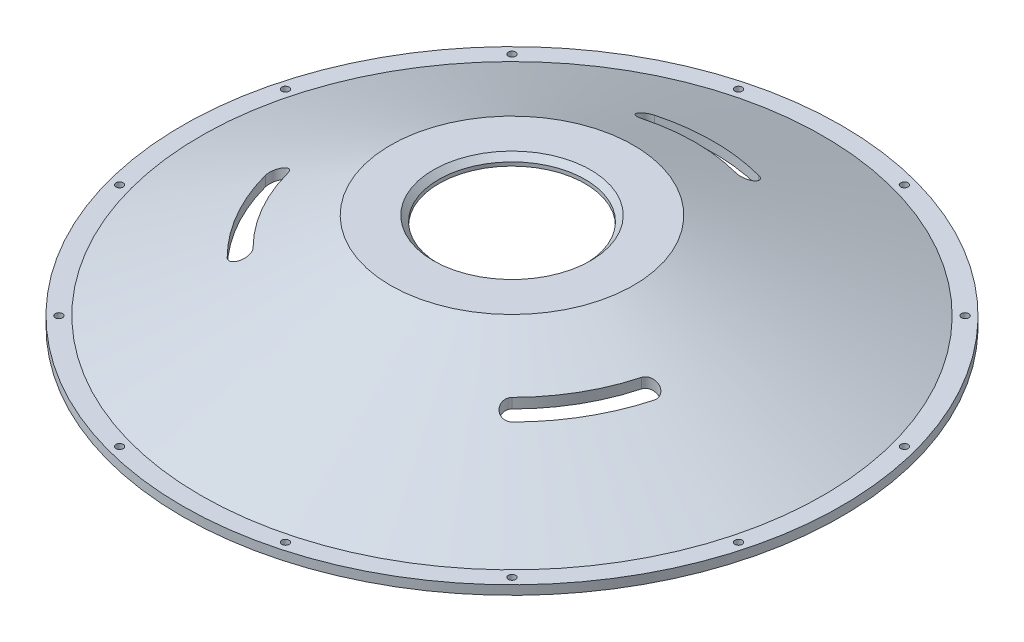
from build123d import *

# Parameters (mm, degrees)
SKETCH_1_R               = 60
SKETCH_1_R_2             = 50
EXTRUDE_1_DEPTH          = 5
SKETCH_2_R               = 53.534713893
SKETCH_2_R_2             = 39.971865105
EXTRUDE_2_DEPTH          = 5
CHAMFER_1_SIZE           = 3
SKETCH_5_R               = 2
CUT_EXTRUDE_1_DEPTH      = 50
PATTERN_CIRCULAR_1_COUNT = 8
EXTRUDE_1213_REACH       = 260.082
SKETCH_6_R               = 3.4
PATTERN_CIRCULAR_2_COUNT = 6
CUT_EXTRUDE_2_DEPTH      = 500
PATTERN_CIRCULAR_3_COUNT = 3
SKETCH_8_R               = 2
EXTRUDE_3_DEPTH          = 5
PATTERN_CIRCULAR_4_COUNT = 4
SKETCH_9_R               = 2
CUT_EXTRUDE_3_DEPTH      = 50
PATTERN_CIRCULAR_5_COUNT = 4
SKETCH_13_R              = 1.5
SKETCH_13_R_2            = 1.603095582
CUT_EXTRUDE_4_DEPTH      = 3
PATTERN_CIRCULAR_6_COUNT = 6


with BuildPart() as part:
    # 草图1 → 凸台-拉伸1 (new body)
    with BuildSketch(Plane(origin=(0, 0, 0), x_dir=(1, 0, 0), z_dir=(0, 1, 0))):
        with Locations(Location((0, 0, 0), (0, 0, 270))):
            Circle(SKETCH_1_R)
        with Locations(Location((0, 0, 0), (0, 0, 270))):
            Circle(SKETCH_1_R_2, mode=Mode.SUBTRACT)
    extrude(amount=EXTRUDE_1_DEPTH)

    # 草图2 → 凸台-拉伸2 (add)
    with BuildSketch(Plane(origin=(0, 5, 0), x_dir=(1, 0, 0), z_dir=(0, 1, 0))):
        Circle(SKETCH_2_R)
        with Locations(Location((0, 0, 0), (0, 0, 270))):
            Circle(SKETCH_2_R_2, mode=Mode.SUBTRACT)
    extrude(amount=-EXTRUDE_2_DEPTH)

    # 倒角1
    chamfer_1_edges = [part.edges().sort_by_distance(p)[0] for p in [
        (0, 5, -39.971865105),
    ]]
    chamfer(chamfer_1_edges, length=CHAMFER_1_SIZE)

    # 草图4 → 旋转1 (revolve)
    with BuildSketch(Plane.XY, mode=Mode.PRIVATE) as revolve_1_sk:
        Polygon((-50.364739438, 0), (-65.273475441, 0), (-168.908736003, -47.5), (-180, -47.5), (-180, -42.5), (-170, -42.5), (-66.364739438, 5), (-50.364739438, 5), align=None)
    revolve(revolve_1_sk.sketch.rotate(Axis((0, 90.942416355, 0), (0, -1, 0)), 270), axis=Axis((0, 90.942416355, 0), (0, -1, 0)))

    # 草图5 → 切除-拉伸1 (cut)
    with BuildSketch(Plane(origin=(0, -42.5, 0), x_dir=(1, 0, 0), z_dir=(0, 1, 0))):
        with Locations(Location((0, 175, 0), (0, 0, 270))):
            Circle(SKETCH_5_R)
    cut_extrude_1 = extrude(amount=-CUT_EXTRUDE_1_DEPTH, mode=Mode.SUBTRACT)

    # 阵列(圆周)1: 切除-拉伸1 ×8 about axis
    pattern_circular_1_axis = Axis((0, 0, 0), (0, 1, 0))
    for i in range(1, PATTERN_CIRCULAR_1_COUNT):
        add(cut_extrude_1.rotate(pattern_circular_1_axis, i * 360 / PATTERN_CIRCULAR_1_COUNT), mode=Mode.SUBTRACT)

    # Extrude 1213: up to this cone (the profile starts inside it)
    extrude_1213_end = Plane(origin=(0, -37.5, 0), z_dir=(0, -1, 0)).offset(-67.417327008) * Cone(2.182e-06, 1036.549216801, 475.090113419, align=(Align.CENTER, Align.CENTER, Align.MIN), mode=Mode.PRIVATE)
    # 草图6 → Extrude 1213 (add, up to the surface)
    with BuildSketch(Plane(origin=(0, -37.5, 0), x_dir=(-1, 0, 0), z_dir=(0, -1, 0)), mode=Mode.PRIVATE) as extrude_1213_sk1:
        with Locations(Location((-110, 0, 0), (0, 0, 90))):
            Circle(SKETCH_6_R)
    extrude_1213_tool1 = extrude(extrude_1213_sk1.sketch, amount=-EXTRUDE_1213_REACH, mode=Mode.PRIVATE) & extrude_1213_end
    extrude_1213 = extrude_1213_tool1.solids().sort_by_distance((110, -37.5, 0))[0]
    add(extrude_1213)

    # 阵列(圆周)2: Extrude 1213 ×6 about axis
    pattern_circular_2_axis = Axis((0, 0, 0), (0, 1, 0))
    for i in range(1, PATTERN_CIRCULAR_2_COUNT):
        add(extrude_1213.rotate(pattern_circular_2_axis, i * 360 / PATTERN_CIRCULAR_2_COUNT))

    # 草图7 → 切除-拉伸2 (cut)
    with BuildSketch(Plane(origin=(0, 5, 0), x_dir=(1, 0, 0), z_dir=(0, 1, 0))):
        with BuildLine():
            ThreePointArc((25.88190451, 96.592582629), (0, 100), (-25.88190451, 96.592582629))
            ThreePointArc((-25.88190451, 96.592582629), (-32.005628867, 100.128116535), (-28.470094961, 106.251840892))
            ThreePointArc((-28.470094961, 106.251840892), (0, 110), (28.470094961, 106.251840892))
            ThreePointArc((28.470094961, 106.251840892), (32.005628867, 100.128116535), (25.88190451, 96.592582629))
        make_face()
    cut_extrude_2 = extrude(amount=-CUT_EXTRUDE_2_DEPTH, mode=Mode.SUBTRACT)

    # 阵列(圆周)3: 切除-拉伸2 ×3 about axis
    pattern_circular_3_axis = Axis((0, 0, 0), (0, 1, 0))
    for i in range(1, PATTERN_CIRCULAR_3_COUNT):
        add(cut_extrude_2.rotate(pattern_circular_3_axis, i * 360 / PATTERN_CIRCULAR_3_COUNT), mode=Mode.SUBTRACT)

    # 草图8 → 凸台-拉伸3 (add)
    with BuildSketch(Plane(origin=(0, -42.5, 0), x_dir=(1, 0, 0), z_dir=(0, 1, 0))):
        with Locations((-175, 0)):
            Circle(SKETCH_8_R)
    extrude_3 = extrude(amount=-EXTRUDE_3_DEPTH)

    # 阵列(圆周)4: 凸台-拉伸3 ×4 about axis
    pattern_circular_4_axis = Axis((0, 90.942416355, 0), (0, 1, 0))
    for i in range(1, PATTERN_CIRCULAR_4_COUNT):
        add(extrude_3.rotate(pattern_circular_4_axis, i * 360 / PATTERN_CIRCULAR_4_COUNT))

    # 草图9 → 切除-拉伸3 (cut)
    with BuildSketch(Plane(origin=(0, -42.5, 0), x_dir=(1, 0, 0), z_dir=(0, 1, 0))):
        with Locations(Location((-169.037019601, 45.293332893, 0), (0, 0, 270))):
            Circle(SKETCH_9_R)
        with Locations(Location((-169.037019601, -45.293332893, 0), (0, 0, 270))):
            Circle(SKETCH_9_R)
    cut_extrude_3 = extrude(amount=-CUT_EXTRUDE_3_DEPTH, mode=Mode.SUBTRACT)

    # 阵列(圆周)5: 切除-拉伸3 ×4 about axis
    pattern_circular_5_axis = Axis((0, 0, 0), (0, 1, 0))
    for i in range(1, PATTERN_CIRCULAR_5_COUNT):
        add(cut_extrude_3.rotate(pattern_circular_5_axis, i * 360 / PATTERN_CIRCULAR_5_COUNT), mode=Mode.SUBTRACT)

    # 草图13 → 切除-拉伸4 (cut)
    with BuildSketch(Plane.XZ.offset(37.5)):
        with Locations(Location((-55, -95.262794416, 0), (0, 0, 270))):
            Circle(SKETCH_13_R)
        Circle(SKETCH_13_R_2)
    cut_extrude_4 = extrude(amount=-CUT_EXTRUDE_4_DEPTH, mode=Mode.SUBTRACT)

    # 阵列(圆周)6: 切除-拉伸4 ×6 about axis
    pattern_circular_6_axis = Axis((0, 0, 0), (0, 1, 0))
    for i in range(1, PATTERN_CIRCULAR_6_COUNT):
        add(cut_extrude_4.rotate(pattern_circular_6_axis, i * 360 / PATTERN_CIRCULAR_6_COUNT), mode=Mode.SUBTRACT)


solid = part.part
